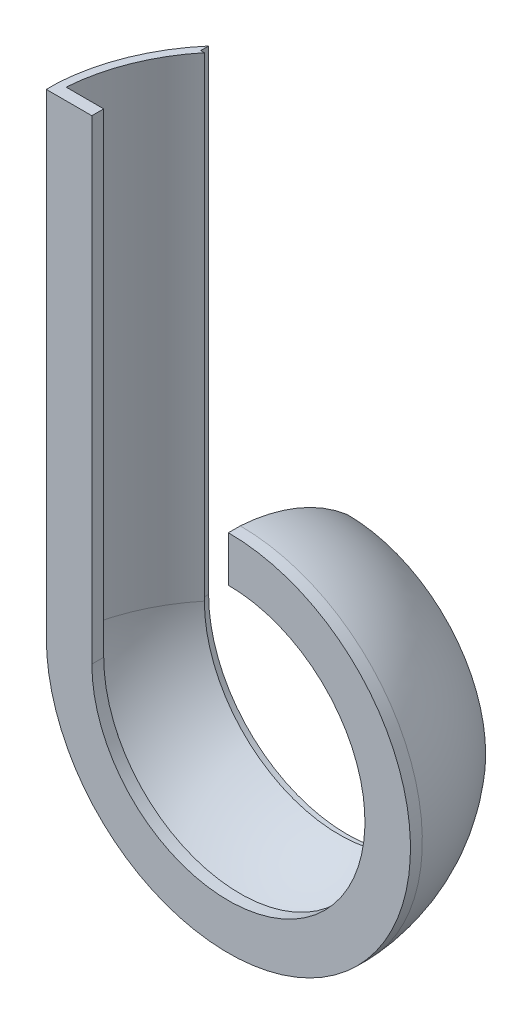
from build123d import *

# Parameters (mm, degrees)
REVOLVE_2_ANGLE = 270
EXTRUDE_1_DEPTH = 120


with BuildPart() as part:
    # 草图2 → 旋转2 (revolve)
    with BuildSketch(Plane(origin=(0, 0, 0), x_dir=(1, 0, 0), z_dir=(0, 1, 0))):
        with BuildLine():
            Line((-34.5, 0), (-34.5, 3))
            Line((-34.5, 3), (-43, 3))
            Line((-43, 3), (-43.995557857, 3))
            ThreePointArc((-43.995557857, 3), (-40.98437005, 16.275457684), (-34.067713618, 28))
            Line((-34.067713618, 28), (-35, 28))
            Line((-35, 28), (-35, 30))
            ThreePointArc((-35, 30), (-42.690748412, 17.392527131), (-46, 3))
            Line((-46, 3), (-46, 0))
            Line((-46, 0), (-34.5, 0))
        make_face()
    revolve(axis=Axis((0, 0, -42), (0, 0, 1)), revolution_arc=REVOLVE_2_ANGLE)

    # 草图2<2> → 凸台-拉伸1 (add)
    with BuildSketch(Plane(origin=(0, 0, 0), x_dir=(1, 0, 0), z_dir=(0, 1, 0))):
        with BuildLine():
            Line((-34.5, 0), (-34.5, 3))
            Line((-34.5, 3), (-43, 3))
            Line((-43, 3), (-43.995557857, 3))
            ThreePointArc((-43.995557857, 3), (-40.98437005, 16.275457684), (-34.067713618, 28))
            Line((-34.067713618, 28), (-35, 28))
            Line((-35, 28), (-35, 30))
            ThreePointArc((-35, 30), (-42.690748412, 17.392527131), (-46, 3))
            Line((-46, 3), (-46, 0))
            Line((-46, 0), (-34.5, 0))
        make_face()
    extrude(amount=EXTRUDE_1_DEPTH)


solid = part.part
